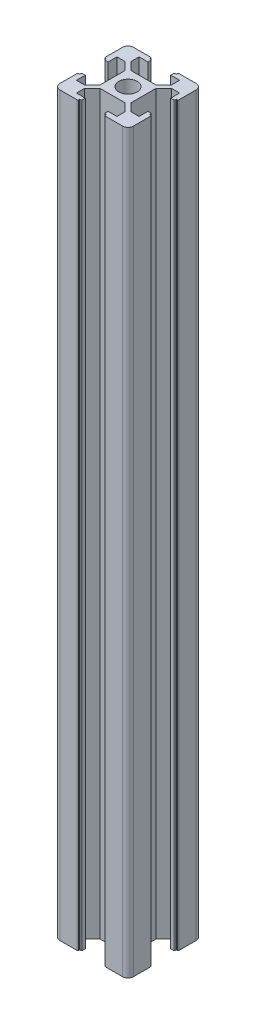
from build123d import *

# Parameters (mm, degrees)
BOSS_EXTRUDE1_DEPTH = 200
SKETCH3_R           = 2.5
CUT_EXTRUDE1_DEPTH  = 201.499376558
CIRPATTERN1_COUNT   = 4


with BuildPart() as part:
    # Sketch2 → Boss-Extrude1 (new body)
    with BuildSketch(Plane(origin=(0, 0, 0), x_dir=(1, 0, 0), z_dir=(0, 1, 0))):
        with BuildLine():
            Line((-10, -8.5), (-10, 8.5))
            ThreePointArc((-10, 8.5), (-9.560660172, 9.560660172), (-8.5, 10))
            Line((-8.5, 10), (8.5, 10))
            ThreePointArc((8.5, 10), (9.560660172, 9.560660172), (10, 8.5))
            Line((10, 8.5), (10, -8.5))
            ThreePointArc((10, -8.5), (9.560660172, -9.560660172), (8.5, -10))
            Line((8.5, -10), (-8.5, -10))
            ThreePointArc((-8.5, -10), (-9.560660172, -9.560660172), (-10, -8.5))
        make_face()
    extrude(amount=BOSS_EXTRUDE1_DEPTH)

    # Sketch3 → Cut-Extrude1 (cut, through all)
    with BuildSketch(Plane(origin=(0, 200, 0), x_dir=(1, 0, 0), z_dir=(0, 1, 0))):
        with BuildLine():
            Line((-6.348528137, -5.5), (-4.2, -3.351471863))
            Line((-4.2, -3.351471863), (-4.2, 3.351471863))
            Line((-4.2, 3.351471863), (-6.348528137, 5.5))
            Line((-6.348528137, 5.5), (-8.5, 5.5))
            Line((-8.5, 5.5), (-8.5, 3.1))
            Line((-8.5, 3.1), (-9.3, 3.1))
            ThreePointArc((-9.3, 3.1), (-9.441421356, 3.158578644), (-9.5, 3.3))
            Line((-9.5, 3.3), (-9.5, 3.6))
            Line((-9.5, 3.6), (-9.8, 3.6))
            ThreePointArc((-9.8, 3.6), (-9.941421356, 3.658578644), (-10, 3.8))
            Line((-10, 3.8), (-10, -3.8))
            ThreePointArc((-10, -3.8), (-9.941421356, -3.658578644), (-9.8, -3.6))
            Line((-9.8, -3.6), (-9.5, -3.6))
            Line((-9.5, -3.6), (-9.5, -3.3))
            ThreePointArc((-9.5, -3.3), (-9.441421356, -3.158578644), (-9.3, -3.1))
            Line((-9.3, -3.1), (-8.5, -3.1))
            Line((-8.5, -3.1), (-8.5, -5.5))
            Line((-8.5, -5.5), (-6.348528137, -5.5))
        make_face()
        Circle(SKETCH3_R)
    cut_extrude1 = extrude(amount=-CUT_EXTRUDE1_DEPTH, mode=Mode.SUBTRACT)

    # CirPattern1: Cut-Extrude1 ×4 about axis
    cirpattern1_axis = Axis((0, -20, 0), (0, 1, 0))
    for i in range(1, CIRPATTERN1_COUNT):
        add(cut_extrude1.rotate(cirpattern1_axis, i * 360 / CIRPATTERN1_COUNT), mode=Mode.SUBTRACT)


solid = part.part
